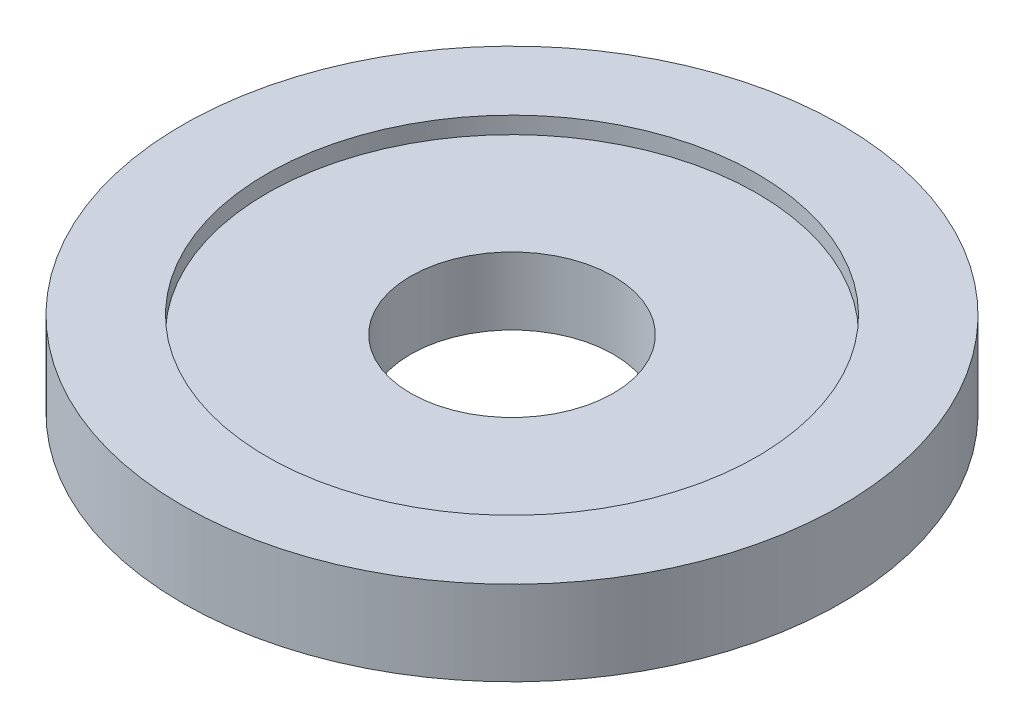
from build123d import *


with BuildPart() as part:
    # Sketch1 → Revolve1 (revolve)
    with BuildSketch(Plane.XY, mode=Mode.PRIVATE) as revolve1_sk:
        Polygon((12, 0), (12, 8), (29, 8), (29, 10), (39, 10), (39, 0), align=None)
    revolve(revolve1_sk.sketch.rotate(Axis((0, 0, 0), (0, 1, 0)), 90), axis=Axis((0, 0, 0), (0, 1, 0)))


solid = part.part
